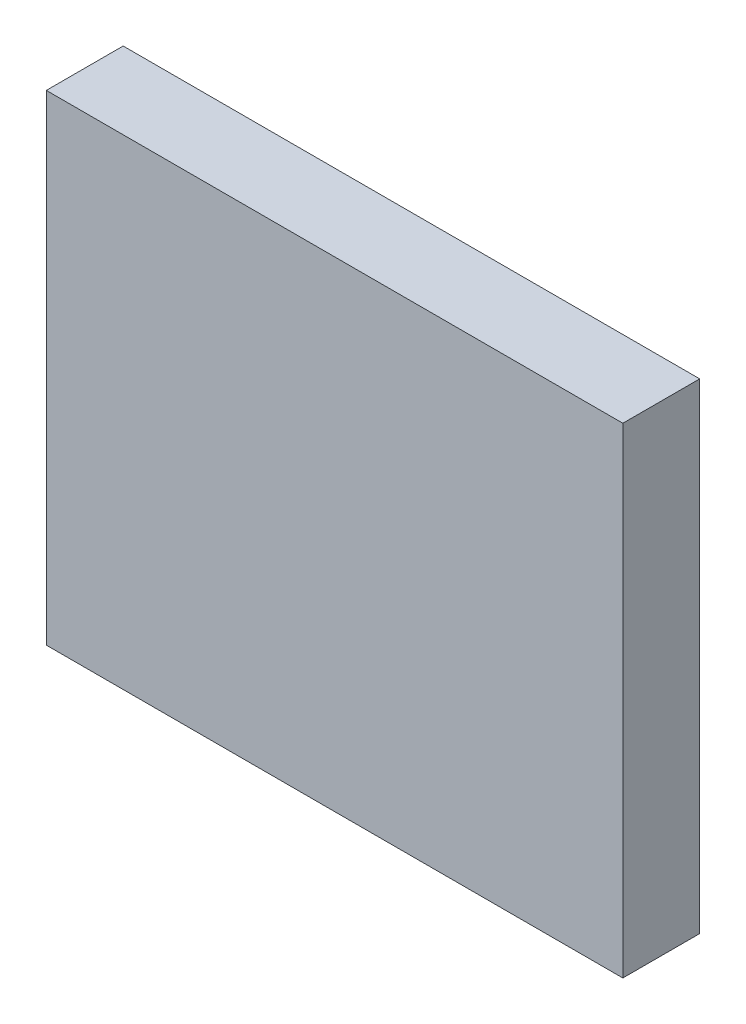
from build123d import *

# Parameters (mm, degrees)
SCHIZZO1_W                   = 30
SCHIZZO1_H                   = 25
ESTRUSIONE_ESTRUSIONE1_DEPTH = 4


with BuildPart() as part:
    # Schizzo1 → Estrusione-Estrusione1 (new body)
    with BuildSketch(Plane.XY):
        with Locations((15, 12.5)):
            Rectangle(SCHIZZO1_W, SCHIZZO1_H)
    extrude(amount=ESTRUSIONE_ESTRUSIONE1_DEPTH)


solid = part.part
